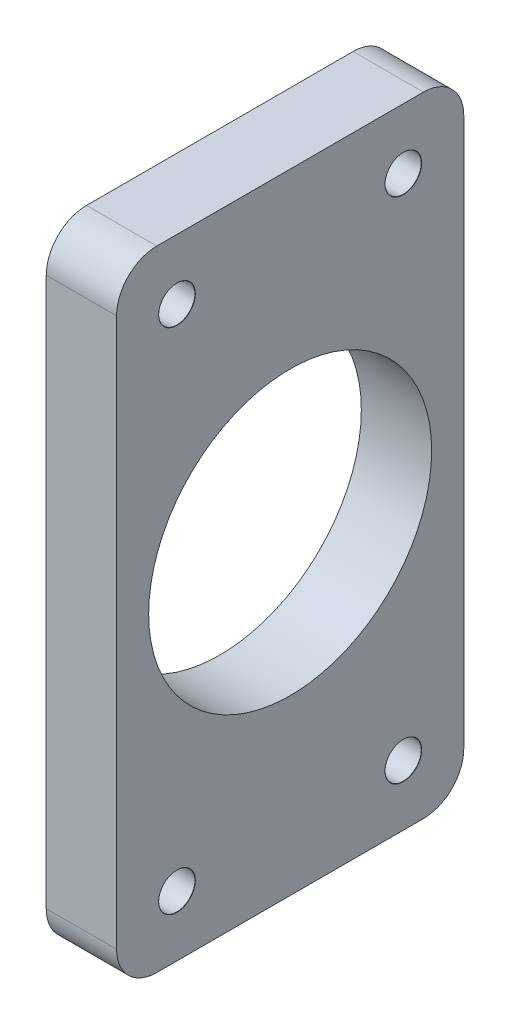
from build123d import *

# Parameters (mm, degrees)
SKETCH1_R                               = 2.25
SKETCH1_R_2                             = 17.5641
BOSS_EXTRUDE1_DEPTH                     = 4.365625
SKETCH2_W                               = 78.1
SKETCH2_H                               = 43.1
BOSS_EXTRUDE2_DEPTH                     = 8.73125
M4_CLEARANCE_HOLE2_AT_2_COUNT           = 2
M4_CLEARANCE_HOLE2_AT_2_PITCH           = 28.1
M4_CLEARANCE_HOLE2_AT_3_COUNT           = 2
M4_CLEARANCE_HOLE2_AT_3_PITCH           = 69.07401827
M4_CLEARANCE_HOLE2_AT_4_COUNT           = 2
M4_CLEARANCE_HOLE2_AT_4_PITCH           = 63.1
SKETCH24_W                              = 78.1
SKETCH24_H                              = 43.1
BOSS_EXTRUDE3_DEPTH                     = 8.73125
TAP_DRILL_FOR_M4X0_7_TAP1_AT_2_COUNT    = 2
TAP_DRILL_FOR_M4X0_7_TAP1_AT_2_PITCH    = 28.1
TAP_DRILL_FOR_M4X0_7_TAP1_AT_3_COUNT    = 2
TAP_DRILL_FOR_M4X0_7_TAP1_AT_3_PITCH    = 69.07401827
TAP_DRILL_FOR_M4X0_7_TAP1_AT_4_COUNT    = 2
TAP_DRILL_FOR_M4X0_7_TAP1_AT_4_PITCH    = 63.1
TAP_DRILL_FOR_M3X0_5_TAP1_AT_2_COUNT    = 2
TAP_DRILL_FOR_M3X0_5_TAP1_AT_2_PITCH    = 36
TAP_DRILL_FOR_M3X0_5_TAP1_AT_3_COUNT    = 2
TAP_DRILL_FOR_M3X0_5_TAP1_AT_3_PITCH    = 28
TAP_DRILL_FOR_M3X0_5_TAP1_AT_4_COUNT    = 2
TAP_DRILL_FOR_M3X0_5_TAP1_AT_4_PITCH    = 45.607017004
TAP_DRILL_FOR_M2_5X0_45_TAP2_AT_2_COUNT = 2
TAP_DRILL_FOR_M2_5X0_45_TAP2_AT_2_PITCH = 15.8
SKETCH3_R                               = 17.5641
CUT_EXTRUDE3_DEPTH                      = 181.027817403
M6_CLEARANCE_HOLE2_AT_2_COUNT           = 2
M6_CLEARANCE_HOLE2_AT_2_PITCH           = 80
SKETCH14_W                              = 86.5
SKETCH14_H                              = 58.5
CUT_EXTRUDE4_DEPTH                      = 2
FILLET4_R                               = 10
M4_CLEARANCE_HOLE1_AT_2_COUNT           = 2
M4_CLEARANCE_HOLE1_AT_2_PITCH           = 14.136551913
M4_CLEARANCE_HOLE1_AT_3_COUNT           = 2
M4_CLEARANCE_HOLE1_AT_3_PITCH           = 7.068275957
M6_CLEARANCE_HOLE1_AT_2_COUNT           = 2
M6_CLEARANCE_HOLE1_AT_2_PITCH           = 25.4
FILLET5_R                               = 5
FILLET6_R                               = 5
SKETCH28_W                              = 15.5
SKETCH28_H                              = 20.75
SKETCH28_R                              = 1.5
BOSS_EXTRUDE4_DEPTH                     = 2.5
FILLET7_R                               = 1
SKETCH29_R                              = 1.5
BOSS_EXTRUDE5_DEPTH                     = 1.5
FILLET8_R                               = 0.5


with BuildPart() as part:
    # Sketch1 → Boss-Extrude1 (new, symmetric)
    with BuildSketch(Plane.YZ):
        Polygon((0, 170.95), (-50, 110.95), (-50, -79.05), (50, -79.05), (50, 110.95), align=None)
        with Locations((-26.25, -56.8)):
            Circle(SKETCH1_R, mode=Mode.SUBTRACT)
        with Locations((-26.25, -32.3)):
            Circle(SKETCH1_R, mode=Mode.SUBTRACT)
        with Locations((26.25, -56.8)):
            Circle(SKETCH1_R, mode=Mode.SUBTRACT)
        with Locations((26.25, -32.3)):
            Circle(SKETCH1_R, mode=Mode.SUBTRACT)
        Circle(SKETCH1_R_2, mode=Mode.SUBTRACT)
    extrude(amount=BOSS_EXTRUDE1_DEPTH, both=True)


with BuildPart() as body_2:
    # Sketch2 → Boss-Extrude2 (new body)
    with BuildSketch(Plane.YZ.offset(4.365625)):
        Rectangle(SKETCH2_W, SKETCH2_H)
    extrude(amount=BOSS_EXTRUDE2_DEPTH)


with BuildPart() as m4_clearance_hole2_tool:
    # Sketch23 → M4 Clearance Hole2 (revolve)
    with BuildSketch(Plane(origin=(13.096875, -31.55, 14.05), x_dir=(0, 0, -1), z_dir=(0, 1, 0))):
        Polygon((0, 0), (0, 17.4625), (2.25, 17.4625), (2.25, 0.025), (2.275, 0), align=None)
    m4_clearance_hole2 = revolve(axis=Axis((19.446875, -31.55, 14.05), (-1, 0, 0)))


with BuildPart() as part_1:
    add(part.part)

    # M4 Clearance Hole2: cut by m4_clearance_hole2_tool
    add(m4_clearance_hole2_tool.part, mode=Mode.SUBTRACT)


with BuildPart() as body_2_1:
    add(body_2.part)

    # M4 Clearance Hole2: cut by m4_clearance_hole2_tool
    add(m4_clearance_hole2_tool.part, mode=Mode.SUBTRACT)


with BuildPart() as m4_clearance_hole2_at_2_tool:
    # M4 Clearance Hole2 at 2: M4 Clearance Hole2 ×2
    with Locations(*[(0, 0, -i * M4_CLEARANCE_HOLE2_AT_2_PITCH) for i in range(1, M4_CLEARANCE_HOLE2_AT_2_COUNT)]):
        add(m4_clearance_hole2)


with BuildPart() as part_2:
    add(part_1.part)

    # M4 Clearance Hole2 at 2: cut by m4_clearance_hole2_at_2_tool
    add(m4_clearance_hole2_at_2_tool.part, mode=Mode.SUBTRACT)


with BuildPart() as body_2_2:
    add(body_2_1.part)

    # M4 Clearance Hole2 at 2: cut by m4_clearance_hole2_at_2_tool
    add(m4_clearance_hole2_at_2_tool.part, mode=Mode.SUBTRACT)


with BuildPart() as m4_clearance_hole2_at_3_tool:
    # M4 Clearance Hole2 at 3: M4 Clearance Hole2 ×2
    with Locations(*[Vector(0, 0.9135128023552276, -0.40680998012966574) * (i * M4_CLEARANCE_HOLE2_AT_3_PITCH) for i in range(1, M4_CLEARANCE_HOLE2_AT_3_COUNT)]):
        add(m4_clearance_hole2)


with BuildPart() as part_3:
    add(part_2.part)

    # M4 Clearance Hole2 at 3: cut by m4_clearance_hole2_at_3_tool
    add(m4_clearance_hole2_at_3_tool.part, mode=Mode.SUBTRACT)


with BuildPart() as body_2_3:
    add(body_2_2.part)

    # M4 Clearance Hole2 at 3: cut by m4_clearance_hole2_at_3_tool
    add(m4_clearance_hole2_at_3_tool.part, mode=Mode.SUBTRACT)


with BuildPart() as m4_clearance_hole2_at_4_tool:
    # M4 Clearance Hole2 at 4: M4 Clearance Hole2 ×2
    with Locations(*[(0, i * M4_CLEARANCE_HOLE2_AT_4_PITCH, 0) for i in range(1, M4_CLEARANCE_HOLE2_AT_4_COUNT)]):
        add(m4_clearance_hole2)


with BuildPart() as part_4:
    add(part_3.part)

    # M4 Clearance Hole2 at 4: cut by m4_clearance_hole2_at_4_tool
    add(m4_clearance_hole2_at_4_tool.part, mode=Mode.SUBTRACT)

    # Sketch7 → Tap Drill for M3x0.5 Tap1 (revolve, cut)
    with BuildSketch(Plane(origin=(4.365625, -18, -24.05), x_dir=(0, 0, -1), z_dir=(0, 1, 0))):
        Polygon((0, 0), (0, 17.4625), (1.25, 17.4625), (1.25, 0.025), (1.275, 0), align=None)
    tap_drill_for_m3x0_5_tap1 = revolve(axis=Axis((10.715625, -18, -24.05), (-1, 0, 0)), mode=Mode.SUBTRACT)

    # Tap Drill for M3x0.5 Tap1 at 2: Tap Drill for M3x0.5 Tap1 ×2
    with Locations(*[(0, i * TAP_DRILL_FOR_M3X0_5_TAP1_AT_2_PITCH, 0) for i in range(1, TAP_DRILL_FOR_M3X0_5_TAP1_AT_2_COUNT)]):
        add(tap_drill_for_m3x0_5_tap1, mode=Mode.SUBTRACT)

    # Tap Drill for M3x0.5 Tap1 at 3: Tap Drill for M3x0.5 Tap1 ×2
    with Locations(*[(0, 0, -i * TAP_DRILL_FOR_M3X0_5_TAP1_AT_3_PITCH) for i in range(1, TAP_DRILL_FOR_M3X0_5_TAP1_AT_3_COUNT)]):
        add(tap_drill_for_m3x0_5_tap1, mode=Mode.SUBTRACT)

    # Tap Drill for M3x0.5 Tap1 at 4: Tap Drill for M3x0.5 Tap1 ×2
    with Locations(*[Vector(0, 0.7893522173763264, -0.6139406135149205) * (i * TAP_DRILL_FOR_M3X0_5_TAP1_AT_4_PITCH) for i in range(1, TAP_DRILL_FOR_M3X0_5_TAP1_AT_4_COUNT)]):
        add(tap_drill_for_m3x0_5_tap1, mode=Mode.SUBTRACT)

    # Sketch10 → Tap Drill for M2.5x0.45 Tap2 (revolve, cut)
    with BuildSketch(Plane(origin=(4.365625, -41, 103.325), x_dir=(0, 0, -1), z_dir=(0, 1, 0))):
        Polygon((0, 0), (0, 17.4625), (1.025, 17.4625), (1.025, 0.025), (1.05, 0), align=None)
    tap_drill_for_m2_5x0_45_tap2 = revolve(axis=Axis((10.715625, -41, 103.325), (-1, 0, 0)), mode=Mode.SUBTRACT)

    # Tap Drill for M2.5x0.45 Tap2 at 2: Tap Drill for M2.5x0.45 Tap2 ×2
    with Locations(*[(0, 0, -i * TAP_DRILL_FOR_M2_5X0_45_TAP2_AT_2_PITCH) for i in range(1, TAP_DRILL_FOR_M2_5X0_45_TAP2_AT_2_COUNT)]):
        add(tap_drill_for_m2_5x0_45_tap2, mode=Mode.SUBTRACT)

    # Sketch12 → M6 Clearance Hole2 (revolve, cut)
    with BuildSketch(Plane(origin=(4.365625, -40, -69.05), x_dir=(0, 0, -1), z_dir=(0, 1, 0))):
        Polygon((0, 0), (0, 17.4625), (3.3, 17.4625), (3.3, 0.025), (3.325, 0), align=None)
    m6_clearance_hole2 = revolve(axis=Axis((10.715625, -40, -69.05), (-1, 0, 0)), mode=Mode.SUBTRACT)

    # M6 Clearance Hole2 at 2: M6 Clearance Hole2 ×2
    with Locations(*[(0, i * M6_CLEARANCE_HOLE2_AT_2_PITCH, 0) for i in range(1, M6_CLEARANCE_HOLE2_AT_2_COUNT)]):
        add(m6_clearance_hole2, mode=Mode.SUBTRACT)

    # Sketch14 → Cut-Extrude4 (cut)
    with BuildSketch(Plane.YZ.offset(4.365625)):
        with Locations((0, 50.8)):
            Rectangle(SKETCH14_W, SKETCH14_H)
    extrude(amount=-CUT_EXTRUDE4_DEPTH, mode=Mode.SUBTRACT)

    # Fillet4
    fillet4_edges = [part_4.edges().sort_by_distance(p)[0] for p in [
        (0, 50, -79.05),
        (0, -50, -79.05),
        (0, 50, 110.95),
        (0, 0, 170.95),
        (0, -50, 110.95),
    ]]
    fillet(fillet4_edges, radius=FILLET4_R)

    # Sketch16 → M4 Clearance Hole1 (revolve, cut)
    with BuildSketch(Plane(origin=(4.365625, 0, 155.329500648), x_dir=(0, 0, -1), z_dir=(0, 1, 0))):
        Polygon((0, 0), (0, 17.4625), (2.25, 17.4625), (2.25, 0.025), (2.275, 0), align=None)
    m4_clearance_hole1 = revolve(axis=Axis((10.715625, 0, 155.329500648), (-1, 0, 0)), mode=Mode.SUBTRACT)

    # M4 Clearance Hole1 at 2: M4 Clearance Hole1 ×2
    with Locations(*[(0, 0, -i * M4_CLEARANCE_HOLE1_AT_2_PITCH) for i in range(1, M4_CLEARANCE_HOLE1_AT_2_COUNT)]):
        add(m4_clearance_hole1, mode=Mode.SUBTRACT)

    # M4 Clearance Hole1 at 3: M4 Clearance Hole1 ×2
    with Locations(*[(0, 0, -i * M4_CLEARANCE_HOLE1_AT_3_PITCH) for i in range(1, M4_CLEARANCE_HOLE1_AT_3_COUNT)]):
        add(m4_clearance_hole1, mode=Mode.SUBTRACT)

    # Sketch21 → M6 Clearance Hole1 (revolve, cut)
    with BuildSketch(Plane(origin=(4.365625, 0, 131.273931646), x_dir=(0, 0, -1), z_dir=(0, 1, 0))):
        Polygon((0, 0), (0, 17.4625), (3.3, 17.4625), (3.3, 0.025), (3.325, 0), align=None)
    m6_clearance_hole1 = revolve(axis=Axis((10.715625, 0, 131.273931646), (-1, 0, 0)), mode=Mode.SUBTRACT)

    # M6 Clearance Hole1 at 2: M6 Clearance Hole1 ×2
    with Locations(*[(0, 0, -i * M6_CLEARANCE_HOLE1_AT_2_PITCH) for i in range(1, M6_CLEARANCE_HOLE1_AT_2_COUNT)]):
        add(m6_clearance_hole1, mode=Mode.SUBTRACT)


with BuildPart() as body_2_4:
    add(body_2_3.part)

    # M4 Clearance Hole2 at 4: cut by m4_clearance_hole2_at_4_tool
    add(m4_clearance_hole2_at_4_tool.part, mode=Mode.SUBTRACT)


with BuildPart() as body_3:
    # Sketch24 → Boss-Extrude3 (new body)
    with BuildSketch(Plane(origin=(-4.365625, 0, 0), x_dir=(0, -1, 0), z_dir=(-1, 0, 0))):
        Rectangle(SKETCH24_W, SKETCH24_H)
    extrude(amount=BOSS_EXTRUDE3_DEPTH)

    # Sketch27 → Tap Drill for M4x0.7 Tap1 (revolve, cut)
    with BuildSketch(Plane(origin=(-13.096875, 31.55, 14.05), x_dir=(0, 0, 1), z_dir=(0, 1, 0))):
        Polygon((0, 0), (0, 9.722670021), (1.65, 8.73125), (1.65, 0.025), (1.675, 0), align=None)
    tap_drill_for_m4x0_7_tap1 = revolve(axis=Axis((-19.446875, 31.55, 14.05), (1, 0, 0)), mode=Mode.SUBTRACT)

    # Tap Drill for M4x0.7 Tap1 at 2: Tap Drill for M4x0.7 Tap1 ×2
    with Locations(*[(0, 0, -i * TAP_DRILL_FOR_M4X0_7_TAP1_AT_2_PITCH) for i in range(1, TAP_DRILL_FOR_M4X0_7_TAP1_AT_2_COUNT)]):
        add(tap_drill_for_m4x0_7_tap1, mode=Mode.SUBTRACT)

    # Tap Drill for M4x0.7 Tap1 at 3: Tap Drill for M4x0.7 Tap1 ×2
    with Locations(*[Vector(0, -0.9135128023552276, -0.40680998012966574) * (i * TAP_DRILL_FOR_M4X0_7_TAP1_AT_3_PITCH) for i in range(1, TAP_DRILL_FOR_M4X0_7_TAP1_AT_3_COUNT)]):
        add(tap_drill_for_m4x0_7_tap1, mode=Mode.SUBTRACT)

    # Tap Drill for M4x0.7 Tap1 at 4: Tap Drill for M4x0.7 Tap1 ×2
    with Locations(*[(0, -i * TAP_DRILL_FOR_M4X0_7_TAP1_AT_4_PITCH, 0) for i in range(1, TAP_DRILL_FOR_M4X0_7_TAP1_AT_4_COUNT)]):
        add(tap_drill_for_m4x0_7_tap1, mode=Mode.SUBTRACT)


with BuildPart() as cut_extrude3_tool:
    # Sketch3 → Cut-Extrude3 (new, through all)
    with BuildSketch(Plane.YZ.offset(13.096875)):
        Circle(SKETCH3_R)
    extrude(amount=-CUT_EXTRUDE3_DEPTH)


with BuildPart() as body_2_5:
    add(body_2_4.part)

    # Cut-Extrude3: cut by cut_extrude3_tool
    add(cut_extrude3_tool.part, mode=Mode.SUBTRACT)

    # Fillet6
    fillet6_edges = [body_2_5.edges().sort_by_distance(p)[0] for p in [
        (8.73125, -39.05, 21.55),
        (8.73125, 39.05, -21.55),
        (8.73125, -39.05, -21.55),
        (8.73125, 39.05, 21.55),
    ]]
    fillet(fillet6_edges, radius=FILLET6_R)


with BuildPart() as body_3_1:
    add(body_3.part)

    # Cut-Extrude3: cut by cut_extrude3_tool
    add(cut_extrude3_tool.part, mode=Mode.SUBTRACT)

    # Fillet5
    fillet5_edges = [body_3_1.edges().sort_by_distance(p)[0] for p in [
        (-8.73125, -39.05, 21.55),
        (-8.73125, -39.05, -21.55),
        (-8.73125, 39.05, -21.55),
        (-8.73125, 39.05, 21.55),
    ]]
    fillet(fillet5_edges, radius=FILLET5_R)


with BuildPart() as body_4:
    # Sketch28 → Boss-Extrude4 (new body)
    with BuildSketch(Plane.YZ.offset(4.365625)):
        with Locations((-46.275, 95.425)):
            Rectangle(SKETCH28_W, SKETCH28_H)
        with Locations((-41, 87.525)):
            Circle(SKETCH28_R, mode=Mode.SUBTRACT)
        with Locations((-41, 103.325)):
            Circle(SKETCH28_R, mode=Mode.SUBTRACT)
    extrude(amount=BOSS_EXTRUDE4_DEPTH)

    # Fillet7
    fillet7_edges = [body_4.edges().sort_by_distance(p)[0] for p in [
        (5.615625, -38.525, 105.8),
        (5.615625, -38.525, 85.05),
        (5.615625, -54.025, 85.05),
        (5.615625, -54.025, 105.8),
    ]]
    fillet(fillet7_edges, radius=FILLET7_R)

    # Sketch29 → Boss-Extrude5 (add)
    with BuildSketch(Plane(origin=(4.365625, 0, 0), x_dir=(0, -1, 0), z_dir=(-1, 0, 0))):
        with Locations((52.025, 104.175)):
            Circle(SKETCH29_R)
        with Locations((52.025, 100.675)):
            Circle(SKETCH29_R)
        with Locations((52.025, 97.175)):
            Circle(SKETCH29_R)
        with Locations((52.025, 93.675)):
            Circle(SKETCH29_R)
        with Locations((52.025, 90.175)):
            Circle(SKETCH29_R)
        with Locations((52.025, 86.675)):
            Circle(SKETCH29_R)
    extrude(amount=BOSS_EXTRUDE5_DEPTH)

    # Fillet8
    fillet8_edges = [body_4.edges().sort_by_distance(p)[0] for p in [
        (2.865625, -50.525, 86.675),
        (2.865625, -50.525, 90.175),
        (2.865625, -50.525, 93.675),
        (2.865625, -50.525, 97.175),
        (2.865625, -50.525, 100.675),
        (2.865625, -50.525, 104.175),
    ]]
    fillet(fillet8_edges, radius=FILLET8_R)


solid = body_2_5.part
